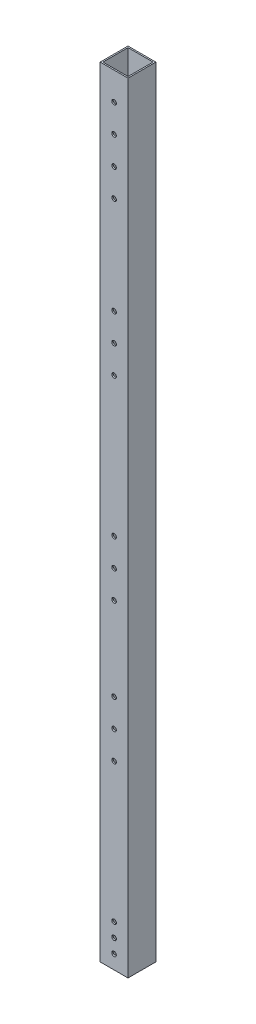
from build123d import *

# Parameters (mm, degrees)
SKETCH_1_W          = 20
SKETCH_1_H          = 20
SKETCH_1_W_2        = 18
SKETCH_1_H_2        = 18
EXTRUDE_1_DEPTH     = 740
SKETCH_3_R          = 1.65
CUT_EXTRUDE_1_DEPTH = 32
SKETCH_5_R          = 15.397397092
CUT_EXTRUDE_2_DEPTH = 180
SKETCH_7_R          = 1.65
CUT_EXTRUDE_3_DEPTH = 40


with BuildPart() as part:
    # 草图1 → 凸台-拉伸1 (new body)
    with BuildSketch(Plane(origin=(0, 0, 0), x_dir=(1, 0, 0), z_dir=(0, 1, 0))):
        Rectangle(SKETCH_1_W, SKETCH_1_H)
        Rectangle(SKETCH_1_W_2, SKETCH_1_H_2, mode=Mode.SUBTRACT)
    extrude(amount=EXTRUDE_1_DEPTH)

    # 草图3 → 切除-拉伸1 (cut)
    with BuildSketch(Plane.XY.offset(10)):
        with Locations((0, 720)):
            Circle(SKETCH_3_R)
        with Locations((0, 700)):
            Circle(SKETCH_3_R)
        with Locations((0, 680)):
            Circle(SKETCH_3_R)
        with Locations((0, 660)):
            Circle(SKETCH_3_R)
        with Locations((0, 590)):
            Circle(SKETCH_3_R)
        with Locations((0, 570)):
            Circle(SKETCH_3_R)
        with Locations((0, 550)):
            Circle(SKETCH_3_R)
        with Locations((0, 450)):
            Circle(SKETCH_3_R)
        with Locations((0, 430)):
            Circle(SKETCH_3_R)
        with Locations((0, 410)):
            Circle(SKETCH_3_R)
    extrude(amount=-CUT_EXTRUDE_1_DEPTH, mode=Mode.SUBTRACT)

    # 草图5 → 切除-拉伸2 (cut)
    with BuildSketch(Plane.XZ):
        Circle(SKETCH_5_R)
    extrude(amount=-CUT_EXTRUDE_2_DEPTH, mode=Mode.SUBTRACT)

    # 草图7 → 切除-拉伸3 (cut)
    with BuildSketch(Plane.XY.offset(10)):
        with Locations((0, 190)):
            Circle(SKETCH_7_R)
        with Locations((0, 200)):
            Circle(SKETCH_7_R)
        with Locations((0, 210)):
            Circle(SKETCH_7_R)
        with Locations((0, 310)):
            Circle(SKETCH_7_R)
        with Locations((0, 330)):
            Circle(SKETCH_7_R)
        with Locations((0, 350)):
            Circle(SKETCH_7_R)
    extrude(amount=-CUT_EXTRUDE_3_DEPTH, mode=Mode.SUBTRACT)


solid = part.part
